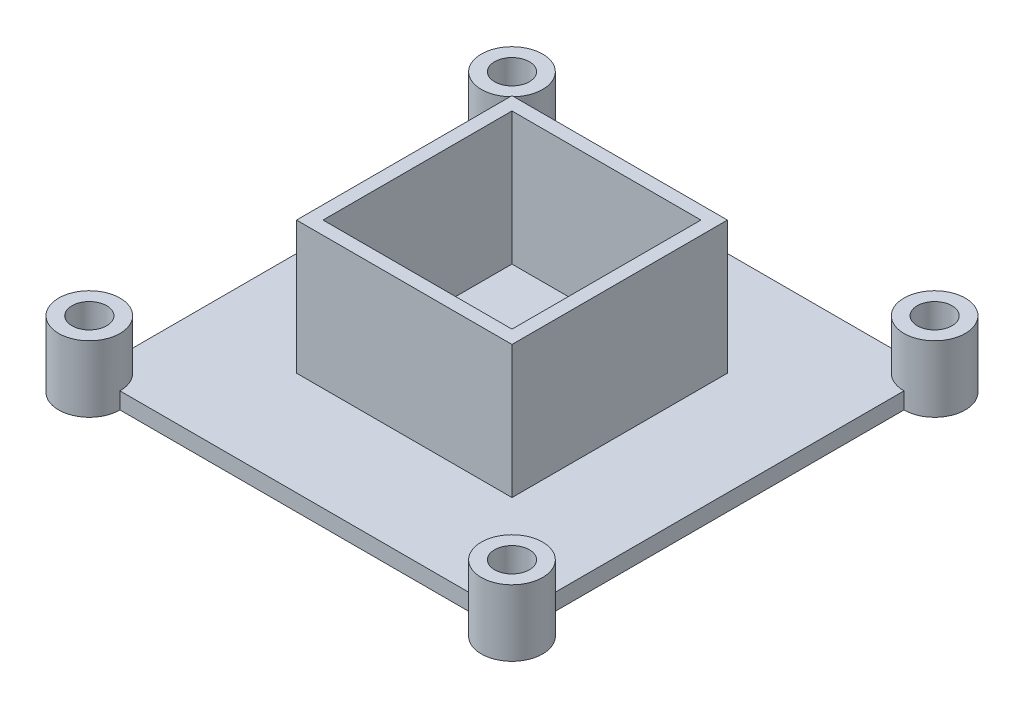
from build123d import *

# Parameters (mm, degrees)
SKETCH1_R           = 1.05
BOSS_EXTRUDE2_DEPTH = 1
BOSS_EXTRUDE4_START = 3
BOSS_EXTRUDE4_DEPTH = 3
SKETCH2_W           = 13
SKETCH2_H           = 13
SKETCH2_W_2         = 11.4
SKETCH2_H_2         = 11.4
BOSS_EXTRUDE5_DEPTH = 8


with BuildPart() as part:
    # Sketch1 → Boss-Extrude2 (new body)
    with BuildSketch(Plane(origin=(0, 0, 0), x_dir=(1, 0, 0), z_dir=(0, 1, 0))):
        with BuildLine():
            ThreePointArc((-10.5, -8.65), (-11.808147545, -11.808147545), (-8.65, -10.5))
            Line((-8.65, -10.5), (13.15, -10.5))
            ThreePointArc((13.15, -10.5), (16.308147545, -11.808147545), (15, -8.65))
            Line((15, -8.65), (15, 13.15))
            ThreePointArc((15, 13.15), (16.308147545, 16.308147545), (13.15, 15))
            Line((13.15, 15), (-8.65, 15))
            ThreePointArc((-8.65, 15), (-11.808147545, 16.308147545), (-10.5, 13.15))
            Line((-10.5, 13.15), (-10.5, -8.65))
        make_face()
        with Locations((-10.5, -10.5)):
            Circle(SKETCH1_R, mode=Mode.SUBTRACT)
        with Locations((-10.5, 15)):
            Circle(SKETCH1_R, mode=Mode.SUBTRACT)
        with Locations((15, 15)):
            Circle(SKETCH1_R, mode=Mode.SUBTRACT)
        with Locations((15, -10.5)):
            Circle(SKETCH1_R, mode=Mode.SUBTRACT)
    extrude(amount=-BOSS_EXTRUDE2_DEPTH)

    # Sketch1<5> → Boss-Extrude4 (add)
    with BuildSketch(Plane(origin=(0, 0, 0), x_dir=(1, 0, 0), z_dir=(0, 1, 0)).offset(BOSS_EXTRUDE4_START)):
        with BuildLine():
            ThreePointArc((15, -8.65), (13.691852455, -9.191852455), (13.15, -10.5))
            Line((13.15, -10.5), (13.95, -10.5))
            ThreePointArc((13.95, -10.5), (14.25753788, -9.75753788), (15, -9.45))
            Line((15, -9.45), (15, -8.65))
        make_face()
        with BuildLine():
            Line((13.95, -10.5), (13.15, -10.5))
            ThreePointArc((13.15, -10.5), (15, -12.35), (16.85, -10.5))
            ThreePointArc((16.85, -10.5), (16.308147545, -9.191852455), (15, -8.65))
            Line((15, -8.65), (15, -9.45))
            ThreePointArc((15, -9.45), (15.74246212, -9.75753788), (16.05, -10.5))
            ThreePointArc((16.05, -10.5), (15, -11.55), (13.95, -10.5))
        make_face()
        with BuildLine():
            ThreePointArc((15, -8.65), (13.691852455, -9.191852455), (13.15, -10.5))
            Line((13.15, -10.5), (13.95, -10.5))
            ThreePointArc((13.95, -10.5), (14.25753788, -9.75753788), (15, -9.45))
            Line((15, -9.45), (15, -8.65))
        make_face()
        with BuildLine():
            Line((13.95, -10.5), (13.15, -10.5))
            ThreePointArc((13.15, -10.5), (15, -12.35), (16.85, -10.5))
            ThreePointArc((16.85, -10.5), (16.308147545, -9.191852455), (15, -8.65))
            Line((15, -8.65), (15, -9.45))
            ThreePointArc((15, -9.45), (15.74246212, -9.75753788), (16.05, -10.5))
            ThreePointArc((16.05, -10.5), (15, -11.55), (13.95, -10.5))
        make_face()
        with BuildLine():
            ThreePointArc((13.15, 15), (13.691852455, 13.691852455), (15, 13.15))
            Line((15, 13.15), (15, 13.95))
            ThreePointArc((15, 13.95), (14.25753788, 14.25753788), (13.95, 15))
            Line((13.95, 15), (13.15, 15))
        make_face()
        with BuildLine():
            Line((15, 13.95), (15, 13.15))
            ThreePointArc((15, 13.15), (16.308147545, 13.691852455), (16.85, 15))
            ThreePointArc((16.85, 15), (15, 16.85), (13.15, 15))
            Line((13.15, 15), (13.95, 15))
            ThreePointArc((13.95, 15), (15, 16.05), (16.05, 15))
            ThreePointArc((16.05, 15), (15.74246212, 14.25753788), (15, 13.95))
        make_face()
        with BuildLine():
            ThreePointArc((13.15, 15), (13.691852455, 13.691852455), (15, 13.15))
            Line((15, 13.15), (15, 13.95))
            ThreePointArc((15, 13.95), (14.25753788, 14.25753788), (13.95, 15))
            Line((13.95, 15), (13.15, 15))
        make_face()
        with BuildLine():
            Line((15, 13.95), (15, 13.15))
            ThreePointArc((15, 13.15), (16.308147545, 13.691852455), (16.85, 15))
            ThreePointArc((16.85, 15), (15, 16.85), (13.15, 15))
            Line((13.15, 15), (13.95, 15))
            ThreePointArc((13.95, 15), (15, 16.05), (16.05, 15))
            ThreePointArc((16.05, 15), (15.74246212, 14.25753788), (15, 13.95))
        make_face()
        with BuildLine():
            ThreePointArc((-10.5, -9.45), (-9.75753788, -9.75753788), (-9.45, -10.5))
            Line((-9.45, -10.5), (-8.65, -10.5))
            ThreePointArc((-8.65, -10.5), (-9.191852455, -9.191852455), (-10.5, -8.65))
            Line((-10.5, -8.65), (-10.5, -9.45))
        make_face()
        with BuildLine():
            Line((-8.65, -10.5), (-9.45, -10.5))
            ThreePointArc((-9.45, -10.5), (-11.24246212, -11.24246212), (-10.5, -9.45))
            Line((-10.5, -9.45), (-10.5, -8.65))
            ThreePointArc((-10.5, -8.65), (-11.808147545, -11.808147545), (-8.65, -10.5))
        make_face()
        with BuildLine():
            ThreePointArc((-10.5, -9.45), (-9.75753788, -9.75753788), (-9.45, -10.5))
            Line((-9.45, -10.5), (-8.65, -10.5))
            ThreePointArc((-8.65, -10.5), (-9.191852455, -9.191852455), (-10.5, -8.65))
            Line((-10.5, -8.65), (-10.5, -9.45))
        make_face()
        with BuildLine():
            Line((-8.65, -10.5), (-9.45, -10.5))
            ThreePointArc((-9.45, -10.5), (-11.24246212, -11.24246212), (-10.5, -9.45))
            Line((-10.5, -9.45), (-10.5, -8.65))
            ThreePointArc((-10.5, -8.65), (-11.808147545, -11.808147545), (-8.65, -10.5))
        make_face()
        with BuildLine():
            ThreePointArc((-8.65, 15), (-11.808147545, 16.308147545), (-10.5, 13.15))
            Line((-10.5, 13.15), (-10.5, 13.95))
            ThreePointArc((-10.5, 13.95), (-11.24246212, 15.74246212), (-9.45, 15))
            Line((-9.45, 15), (-8.65, 15))
        make_face()
        with BuildLine():
            Line((-10.5, 13.95), (-10.5, 13.15))
            ThreePointArc((-10.5, 13.15), (-9.191852455, 13.691852455), (-8.65, 15))
            Line((-8.65, 15), (-9.45, 15))
            ThreePointArc((-9.45, 15), (-9.75753788, 14.25753788), (-10.5, 13.95))
        make_face()
        with BuildLine():
            ThreePointArc((-8.65, 15), (-11.808147545, 16.308147545), (-10.5, 13.15))
            Line((-10.5, 13.15), (-10.5, 13.95))
            ThreePointArc((-10.5, 13.95), (-11.24246212, 15.74246212), (-9.45, 15))
            Line((-9.45, 15), (-8.65, 15))
        make_face()
        with BuildLine():
            Line((-10.5, 13.95), (-10.5, 13.15))
            ThreePointArc((-10.5, 13.15), (-9.191852455, 13.691852455), (-8.65, 15))
            Line((-8.65, 15), (-9.45, 15))
            ThreePointArc((-9.45, 15), (-9.75753788, 14.25753788), (-10.5, 13.95))
        make_face()
    extrude(amount=-BOSS_EXTRUDE4_DEPTH)

    # Sketch2 → Boss-Extrude5 (add)
    with BuildSketch(Plane(origin=(0, 0, 0), x_dir=(1, 0, 0), z_dir=(0, 1, 0))):
        with Locations((2.25, 2.25)):
            Rectangle(SKETCH2_W, SKETCH2_H)
        with Locations((2.25, 2.25)):
            Rectangle(SKETCH2_W_2, SKETCH2_H_2, mode=Mode.SUBTRACT)
    extrude(amount=BOSS_EXTRUDE5_DEPTH)


solid = part.part
